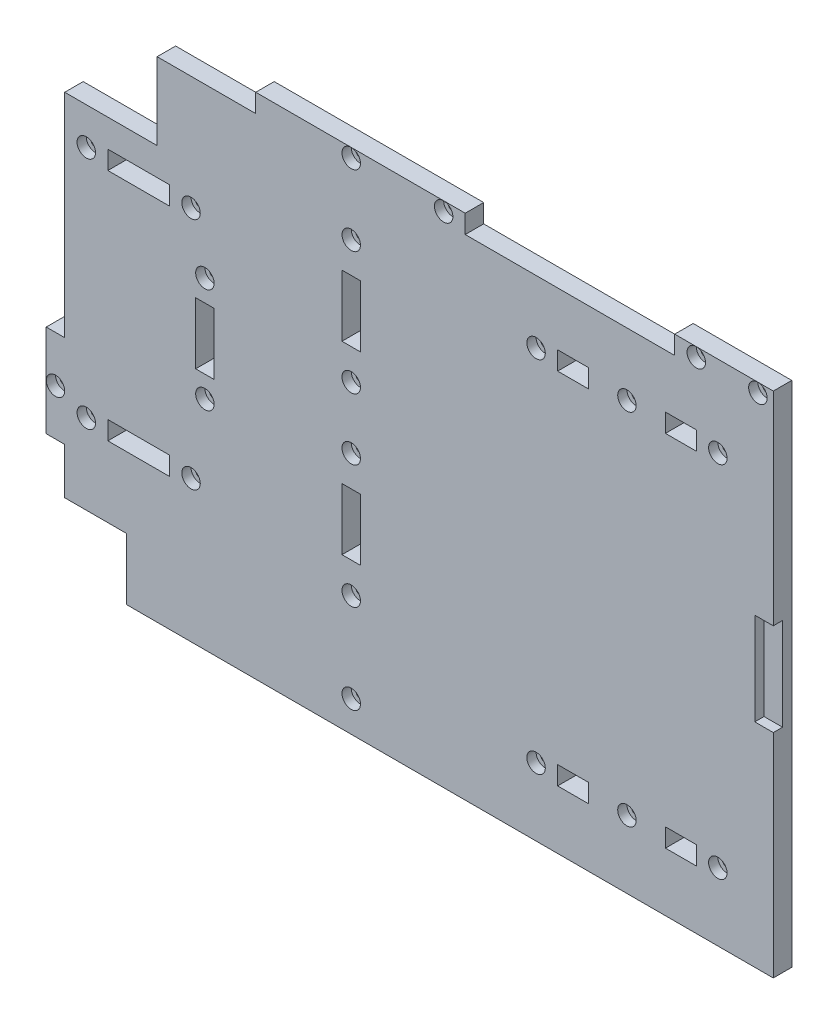
from build123d import *

# Parameters (mm, degrees)
ESQUISSE1_W              = 340
ESQUISSE1_H              = 148
BOSS_EXTRU_1_DEPTH       = 6
ESQUISSE2_W              = 6
ESQUISSE2_H              = 28
ESQUISSE2_H_2            = 18
ESQUISSE2_W_2            = 68
ESQUISSE2_H_3            = 6
ESQUISSE2_H_4            = 30
ENL_V_MAT_EXTRU_1_DEPTH  = 6
ESQUISSE3_W              = 6
ESQUISSE3_H              = 20
ESQUISSE3_W_2            = 30
ESQUISSE3_H_2            = 25
ESQUISSE3_W_3            = 20
ESQUISSE3_H_3            = 6
ENL_V_MAT_EXTRU_2_DEPTH  = 10
ESQUISSE4_R              = 1.5
ESQUISSE4_W              = 10
ESQUISSE4_H              = 6
ENL_V_MAT_EXTRU_3_DEPTH  = 10
ESQUISSE7_W              = 328
ESQUISSE7_H              = 6
BOSS_EXTRU_2_DEPTH       = 17
ESQUISSE8_R              = 1.5
ESQUISSE8_W              = 20
ESQUISSE8_H              = 20
ENL_V_MAT_EXTRU_5_DEPTH  = 371.863856422
ESQUISSE9_R              = 2.995
ESQUISSE9_R_2            = 3
ENL_V_MAT_EXTRU_8_DEPTH  = 3
ESQUISSE10_W             = 130.302032554
ESQUISSE10_H             = 194.077332213
ENL_V_MAT_EXTRU_9_DEPTH  = 371.863856422
ESQUISSE11_W             = 6
ESQUISSE11_H             = 30
ENL_V_MAT_EXTRU_10_DEPTH = 3


with BuildPart() as part:
    # Esquisse1 → Boss.-Extru.1 (new body)
    with BuildSketch(Plane.XY):
        with Locations((-170, 74)):
            Rectangle(ESQUISSE1_W, ESQUISSE1_H)
    extrude(amount=BOSS_EXTRU_1_DEPTH)

    # Esquisse2 → Enlèv. mat.-Extru.1 (cut)
    with BuildSketch(Plane.XY.offset(6)):
        Polygon((-272, 142), (-334, 142), (-334, 48), (-340, 48), (-340, 148), (-272, 148), align=None)
        Polygon((0, 148), (0, 118), (-6, 118), (-6, 142), (-68, 142), (-68, 148), align=None)
        with Locations((-3, 14)):
            Rectangle(ESQUISSE2_W, ESQUISSE2_H)
        with Locations((-337, 9)):
            Rectangle(ESQUISSE2_W, ESQUISSE2_H_2)
        with Locations((-170, 145)):
            Rectangle(ESQUISSE2_W_2, ESQUISSE2_H_3)
        with Locations((-3, 73)):
            Rectangle(ESQUISSE2_W, ESQUISSE2_H_4)
    extrude(amount=-ENL_V_MAT_EXTRU_1_DEPTH, mode=Mode.SUBTRACT)

    # Esquisse3 → Enlèv. mat.-Extru.2 (cut)
    with BuildSketch(Plane.XY.offset(6)):
        with Locations((-241, 42)):
            Rectangle(ESQUISSE3_W, ESQUISSE3_H)
        with Locations((-241, 102)):
            Rectangle(ESQUISSE3_W, ESQUISSE3_H)
        with Locations((-288.5, 70.5)):
            Rectangle(ESQUISSE3_W, ESQUISSE3_H)
        with Locations((-319, 129.5)):
            Rectangle(ESQUISSE3_W_2, ESQUISSE3_H_2)
        with Locations((-310, 105)):
            Rectangle(ESQUISSE3_W_3, ESQUISSE3_H_3)
        with Locations((-310, 29)):
            Rectangle(ESQUISSE3_W_3, ESQUISSE3_H_3)
        with Locations((-67, 102)):
            Rectangle(ESQUISSE3_W, ESQUISSE3_H)
    extrude(amount=-ENL_V_MAT_EXTRU_2_DEPTH, mode=Mode.SUBTRACT)

    # Esquisse4 → Enlèv. mat.-Extru.3 (cut)
    with BuildSketch(Plane.XY.offset(6)):
        with Locations((-151.5, 121.6)):
            Circle(ESQUISSE4_R)
        with Locations((-151.5, 5)):
            Circle(ESQUISSE4_R)
        with Locations((-169, 121.6)):
            Rectangle(ESQUISSE4_W, ESQUISSE4_H)
        with Locations((-134, 121.6)):
            Rectangle(ESQUISSE4_W, ESQUISSE4_H)
        with Locations((-134, 5)):
            Rectangle(ESQUISSE4_W, ESQUISSE4_H)
        with Locations((-169, 5)):
            Rectangle(ESQUISSE4_W, ESQUISSE4_H)
    extrude(amount=-ENL_V_MAT_EXTRU_3_DEPTH, mode=Mode.SUBTRACT)

    # Esquisse7 → Boss.-Extru.2 (add)
    with BuildSketch(Plane.XZ):
        with Locations((-170, 3)):
            Rectangle(ESQUISSE7_W, ESQUISSE7_H)
    extrude(amount=BOSS_EXTRU_2_DEPTH)

    # Esquisse8 → Enlèv. mat.-Extru.5 (cut, through all)
    with BuildSketch(Plane.XY.offset(6)):
        with Locations((-75, 145)):
            Circle(ESQUISSE8_R)
        with Locations((-129, 145)):
            Circle(ESQUISSE8_R)
        with Locations((-109, 145)):
            Circle(ESQUISSE8_R)
        with Locations((-3, 111)):
            Circle(ESQUISSE8_R)
        with Locations((-3, 95)):
            Circle(ESQUISSE8_R)
        with Locations((-3, 51)):
            Circle(ESQUISSE8_R)
        with Locations((-3, 35)):
            Circle(ESQUISSE8_R)
        with Locations((-122, 121.6)):
            Circle(ESQUISSE8_R)
        with Locations((-181, 121.6)):
            Circle(ESQUISSE8_R)
        with Locations((-122, 5)):
            Circle(ESQUISSE8_R)
        with Locations((-181, 5)):
            Circle(ESQUISSE8_R)
        with Locations((-211, 145)):
            Circle(ESQUISSE8_R)
        with Locations((-241, 145)):
            Circle(ESQUISSE8_R)
        with Locations((-241, 122)):
            Circle(ESQUISSE8_R)
        with Locations((-241, 82)):
            Circle(ESQUISSE8_R)
        with Locations((-241, 62)):
            Circle(ESQUISSE8_R)
        with Locations((-241, 22)):
            Circle(ESQUISSE8_R)
        with Locations((-241, -7)):
            Circle(ESQUISSE8_R)
        with Locations((-288.5, 87.5)):
            Circle(ESQUISSE8_R)
        with Locations((-288.5, 53.5)):
            Circle(ESQUISSE8_R)
        with Locations((-293, 105)):
            Circle(ESQUISSE8_R)
        with Locations((-327, 105)):
            Circle(ESQUISSE8_R)
        with Locations((-293, 29)):
            Circle(ESQUISSE8_R)
        with Locations((-327, 29)):
            Circle(ESQUISSE8_R)
        with Locations((-337, 33)):
            Circle(ESQUISSE8_R)
        with Locations((-324, -7)):
            Rectangle(ESQUISSE8_W, ESQUISSE8_H)
    extrude(amount=-ENL_V_MAT_EXTRU_5_DEPTH, mode=Mode.SUBTRACT)

    # Esquisse9 → Enlèv. mat.-Extru.8 (cut)
    with BuildSketch(Plane.XY.offset(6)):
        with Locations((-337, 33)):
            Circle(ESQUISSE9_R)
        with Locations((-327, 29)):
            Circle(ESQUISSE9_R_2)
        with Locations((-293, 29)):
            Circle(ESQUISSE9_R_2)
        with Locations((-288.5, 53.5)):
            Circle(ESQUISSE9_R_2)
        with Locations((-288.5, 87.5)):
            Circle(ESQUISSE9_R_2)
        with Locations((-293, 105)):
            Circle(ESQUISSE9_R_2)
        with Locations((-327, 105)):
            Circle(ESQUISSE9_R_2)
        with Locations((-241, 145)):
            Circle(ESQUISSE9_R)
        with Locations((-241, 122)):
            Circle(ESQUISSE9_R)
        with Locations((-241, 82)):
            Circle(ESQUISSE9_R)
        with Locations((-241, 62)):
            Circle(ESQUISSE9_R_2)
        with Locations((-241, 22)):
            Circle(ESQUISSE9_R_2)
        with Locations((-241, -7)):
            Circle(ESQUISSE9_R_2)
        with Locations((-211, 145)):
            Circle(ESQUISSE9_R)
        with Locations((-181, 121.6)):
            Circle(ESQUISSE9_R)
        with Locations((-151.5, 121.6)):
            Circle(ESQUISSE9_R)
        with Locations((-129, 145)):
            Circle(ESQUISSE9_R)
        with Locations((-122, 121.6)):
            Circle(ESQUISSE9_R)
        with Locations((-109, 145)):
            Circle(ESQUISSE9_R)
        with Locations((-122, 5)):
            Circle(ESQUISSE9_R)
        with Locations((-151.5, 5)):
            Circle(ESQUISSE9_R)
        with Locations((-181, 5)):
            Circle(ESQUISSE9_R)
        with Locations((-75, 145)):
            Circle(ESQUISSE9_R)
        with Locations((-3, 111)):
            Circle(ESQUISSE9_R)
        with Locations((-3, 95)):
            Circle(ESQUISSE9_R)
        with Locations((-3, 51)):
            Circle(ESQUISSE9_R)
        with Locations((-3, 35)):
            Circle(ESQUISSE9_R)
    extrude(amount=-ENL_V_MAT_EXTRU_8_DEPTH, mode=Mode.SUBTRACT)

    # Esquisse10 → Enlèv. mat.-Extru.9 (cut, through all)
    with BuildSketch(Plane.XY.offset(6)):
        with Locations((-38.848983723, 50.961333893)):
            Rectangle(ESQUISSE10_W, ESQUISSE10_H)
    extrude(amount=-ENL_V_MAT_EXTRU_9_DEPTH, mode=Mode.SUBTRACT)

    # Esquisse11 → Enlèv. mat.-Extru.10 (cut)
    with BuildSketch(Plane.XY.offset(6)):
        with Locations((-107, 67)):
            Rectangle(ESQUISSE11_W, ESQUISSE11_H)
    extrude(amount=-ENL_V_MAT_EXTRU_10_DEPTH, mode=Mode.SUBTRACT)


solid = part.part
